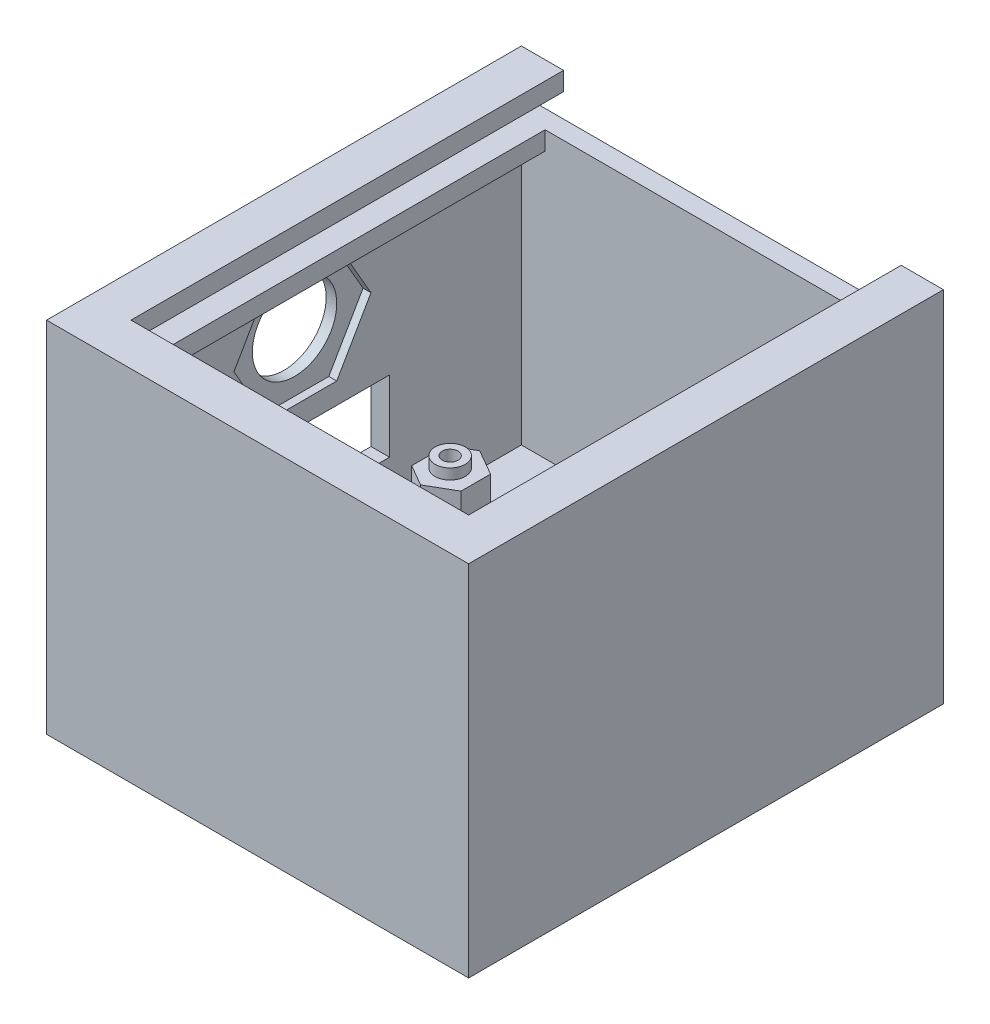
from build123d import *

# Parameters (mm, degrees)
SKETCH1_W               = 80
SKETCH1_H               = 90
BOSS_EXTRUDE1_DEPTH     = 6
SKETCH4_W               = 80
SKETCH4_H               = 90
SKETCH4_W_2             = 73
SKETCH4_H_2             = 83
BOSS_EXTRUDE2_DEPTH     = 54
SKETCH6_R               = 4.05
SKETCH6_R_2             = 5
CUT_EXTRUDE1_DEPTH      = 40
SKETCH7_R               = 7
CUT_EXTRUDE2_DEPTH      = 2.8
BOSS_EXTRUDE3_DEPTH     = 7
SKETCH11_R              = 2.85
BOSS_EXTRUDE4_DEPTH     = 2
CUT_EXTRUDE3_DEPTH      = 9
CUT_EXTRUDE3_DEPTH_BACK = 6
SKETCH5_R               = 1.5
CUT_EXTRUDE4_DEPTH      = 6
CUT_EXTRUDE4_DEPTH_BACK = 81.876448982
SKETCH12_W              = 33
SKETCH12_H              = 13.5
CUT_EXTRUDE6_DEPTH      = 3.5
SKETCH17_R              = 8
CUT_EXTRUDE8_DEPTH      = 2
CUT_EXTRUDE9_DEPTH      = 1.5
CUT_EXTRUDE10_DEPTH     = 10
BOSS_EXTRUDE5_DEPTH     = 90
BOSS_EXTRUDE5_2_DEPTH   = 90
SKETCH21_W              = 3.5
SKETCH21_H              = 8
BOSS_EXTRUDE6_DEPTH     = 80
SKETCH22_W              = 80
SKETCH22_H              = 3.5
BOSS_EXTRUDE7_DEPTH     = 4.5
SKETCH24_W              = 8
SKETCH24_H              = 3.5
BOSS_EXTRUDE8_DEPTH     = 90


with BuildPart() as part:
    # Sketch1 → Boss-Extrude1 (new body)
    with BuildSketch(Plane(origin=(0, 0, 0), x_dir=(1, 0, 0), z_dir=(0, 1, 0))):
        Rectangle(SKETCH1_W, SKETCH1_H)
    extrude(amount=BOSS_EXTRUDE1_DEPTH)

    # Sketch4 → Boss-Extrude2 (add)
    with BuildSketch(Plane(origin=(0, 6, 0), x_dir=(1, 0, 0), z_dir=(0, 1, 0))):
        Rectangle(SKETCH4_W, SKETCH4_H)
        Rectangle(SKETCH4_W_2, SKETCH4_H_2, mode=Mode.SUBTRACT)
    extrude(amount=BOSS_EXTRUDE2_DEPTH)

    # Sketch6 → Cut-Extrude1 (cut)
    with BuildSketch(Plane(origin=(0, 6, 0), x_dir=(1, 0, 0), z_dir=(0, 1, 0))):
        with Locations(Location((-20, 25, 0), (0, 0, 270))):
            Circle(SKETCH6_R)
        with Locations(Location((-20, -25, 0), (0, 0, 270))):
            Circle(SKETCH6_R)
        with Locations(Location((20, -25, 0), (0, 0, 270))):
            Circle(SKETCH6_R_2)
    extrude(amount=-CUT_EXTRUDE1_DEPTH, mode=Mode.SUBTRACT)

    # Sketch7 → Cut-Extrude2 (cut)
    with BuildSketch(Plane(origin=(0, 6, 0), x_dir=(1, 0, 0), z_dir=(0, 1, 0))):
        with Locations(Location((-20, 25, 0), (0, 0, 270))):
            Circle(SKETCH7_R)
        with Locations(Location((-20, -25, 0), (0, 0, 270))):
            Circle(SKETCH7_R)
    extrude(amount=-CUT_EXTRUDE2_DEPTH, mode=Mode.SUBTRACT)

    # Sketch10 → Boss-Extrude3 (add)
    with BuildSketch(Plane(origin=(0, 6, 0), x_dir=(1, 0, 0), z_dir=(0, 1, 0))):
        Polygon((-32.5, 29.600297611), (-37.35, 26.800148806), (-37.35, 21.199851194), (-32.5, 18.399702389), (-27.65, 21.199851194), (-27.65, 26.800148806), align=None)
        Polygon((2.8, 19.600297611), (-2.05, 16.800148806), (-2.05, 11.199851194), (2.8, 8.399702389), (7.65, 11.199851194), (7.65, 16.800148806), align=None)
        Polygon((2.8, -8.399702389), (-2.05, -11.199851194), (-2.05, -16.800148806), (2.8, -19.600297611), (7.65, -16.800148806), (7.65, -11.199851194), align=None)
        Polygon((-27.65, -21.199851194), (-32.5, -18.399702389), (-37.35, -21.199851194), (-37.35, -26.800148806), (-32.5, -29.600297611), (-27.65, -26.800148806), align=None)
    extrude(amount=BOSS_EXTRUDE3_DEPTH)

    # Sketch11 → Boss-Extrude4 (add)
    with BuildSketch(Plane(origin=(0, 13, 0), x_dir=(1, 0, 0), z_dir=(0, 1, 0))):
        with Locations(Location((-32.5, 24, 0), (0, 0, 270))):
            Circle(SKETCH11_R)
        with Locations(Location((2.8, 14, 0), (0, 0, 270))):
            Circle(SKETCH11_R)
        with Locations(Location((2.8, -14, 0), (0, 0, 270))):
            Circle(SKETCH11_R)
        with Locations(Location((-32.5, -24, 0), (0, 0, 270))):
            Circle(SKETCH11_R)
    extrude(amount=BOSS_EXTRUDE4_DEPTH)

    # Sketch5 → Cut-Extrude3 (cut, two sides: drawn at the far end of the back side and taken through both)
    with BuildSketch(Plane(origin=(0, 6, 0), x_dir=(1, 0, 0), z_dir=(0, 1, 0)).offset(-CUT_EXTRUDE3_DEPTH_BACK)):
        with Locations(Location((-32.5, 24, 0), (0, 0, 270))):
            Circle(SKETCH5_R)
        with Locations(Location((-32.5, -24, 0), (0, 0, 270))):
            Circle(SKETCH5_R)
        with Locations(Location((2.8, 14, 0), (0, 0, 270))):
            Circle(SKETCH5_R)
        with Locations(Location((2.8, -14, 0), (0, 0, 270))):
            Circle(SKETCH5_R)
    extrude(amount=CUT_EXTRUDE3_DEPTH + CUT_EXTRUDE3_DEPTH_BACK, mode=Mode.SUBTRACT)

    # Sketch8 → Cut-Extrude4 (cut, two sides: drawn at the far end of the back side and taken through both)
    with BuildSketch(Plane(origin=(0, 6, 0), x_dir=(1, 0, 0), z_dir=(0, 1, 0)).offset(-CUT_EXTRUDE4_DEPTH_BACK)):
        Polygon((-29.65, 25.645448267), (-32.5, 27.290896534), (-35.35, 25.645448267), (-35.35, 22.354551733), (-32.5, 20.709103466), (-29.65, 22.354551733), align=None)
        Polygon((-29.65, -22.354551733), (-32.5, -20.709103466), (-35.35, -22.354551733), (-35.35, -25.645448267), (-32.5, -27.290896534), (-29.65, -25.645448267), align=None)
        Polygon((5.65, -12.354551733), (2.8, -10.709103466), (-0.05, -12.354551733), (-0.05, -15.645448267), (2.8, -17.290896534), (5.65, -15.645448267), align=None)
        Polygon((5.65, 15.645448267), (2.8, 17.290896534), (-0.05, 15.645448267), (-0.05, 12.354551733), (2.8, 10.709103466), (5.65, 12.354551733), align=None)
    extrude(amount=CUT_EXTRUDE4_DEPTH + CUT_EXTRUDE4_DEPTH_BACK, mode=Mode.SUBTRACT)

    # Sketch12 → Cut-Extrude6 (cut)
    with BuildSketch(Plane(origin=(-36.5, 0, 0), x_dir=(0, 0, -1), z_dir=(1, 0, 0))):
        with Locations((0, 23.25)):
            Rectangle(SKETCH12_W, SKETCH12_H)
    extrude(amount=-CUT_EXTRUDE6_DEPTH, mode=Mode.SUBTRACT)

    # Sketch17 → Cut-Extrude8 (cut)
    with BuildSketch(Plane.ZY.offset(40)):
        with Locations((0, 45.25)):
            Circle(SKETCH17_R)
    extrude(amount=-CUT_EXTRUDE8_DEPTH, mode=Mode.SUBTRACT)

    # Sketch15 → Cut-Extrude9 (cut)
    with BuildSketch(Plane(origin=(-36.5, 0, 0), x_dir=(0, 0, -1), z_dir=(1, 0, 0))):
        Polygon((-6.495190528, 56.5), (-12.990381057, 45.25), (-6.495190528, 34), (6.495190528, 34), (12.990381057, 45.25), (6.495190528, 56.5), align=None)
    extrude(amount=-CUT_EXTRUDE9_DEPTH, mode=Mode.SUBTRACT)

    # Sketch19 → Cut-Extrude10 (cut)
    with BuildSketch(Plane(origin=(0, 6, 0), x_dir=(1, 0, 0), z_dir=(0, 1, 0))):
        with BuildLine():
            Line((-3.5, -5.5), (-3.5, 5.5))
            ThreePointArc((-3.5, 5.5), (0, 9), (3.5, 5.5))
            Line((3.5, 5.5), (3.5, -5.5))
            ThreePointArc((3.5, -5.5), (0, -9), (-3.5, -5.5))
        make_face()
    extrude(amount=-CUT_EXTRUDE10_DEPTH, mode=Mode.SUBTRACT)



with BuildPart() as body_2:
    # Sketch20 → Boss-Extrude5 (new body)
    with BuildSketch(Plane(origin=(0, 0, -45), x_dir=(-1, 0, 0), z_dir=(0, 0, -1))):
        Polygon((-40, 60), (-36.5, 60), (-36.5, 64.5), (-32, 64.5), (-32, 68), (-40, 68), align=None)
    extrude(amount=-BOSS_EXTRUDE5_DEPTH)


with BuildPart() as body_3:
    # Sketch20 → Boss-Extrude5 2 (new body)
    with BuildSketch(Plane(origin=(0, 0, -45), x_dir=(-1, 0, 0), z_dir=(0, 0, -1))):
        Polygon((40, 60), (36.5, 60), (36.5, 64.5), (32, 64.5), (32, 68), (40, 68), align=None)
    extrude(amount=-BOSS_EXTRUDE5_2_DEPTH)


with BuildPart() as part_1:
    add(part.part)

    add(body_2.part)  # Boss-Extrude6 merges body 2
    # Sketch21 → Boss-Extrude6 (add)
    with BuildSketch(Plane(origin=(40, 0, 0), x_dir=(0, 0, -1), z_dir=(1, 0, 0))):
        with Locations((-43.25, 64)):
            Rectangle(SKETCH21_W, SKETCH21_H)
    extrude(amount=-BOSS_EXTRUDE6_DEPTH)


    add(body_3.part)  # Boss-Extrude7 merges body 3
    # Sketch22 → Boss-Extrude7 (add)
    with BuildSketch(Plane(origin=(0, 0, 41.5), x_dir=(-1, 0, 0), z_dir=(0, 0, -1))):
        with Locations((0, 66.25)):
            Rectangle(SKETCH22_W, SKETCH22_H)
    extrude(amount=BOSS_EXTRUDE7_DEPTH)

    # Sketch24 → Boss-Extrude8 (add)
    with BuildSketch(Plane.XY.offset(45)):
        with Locations((-36, 58.25)):
            Rectangle(SKETCH24_W, SKETCH24_H)
        with Locations((36, 58.25)):
            Rectangle(SKETCH24_W, SKETCH24_H)
    extrude(amount=-BOSS_EXTRUDE8_DEPTH)


solid = part_1.part
